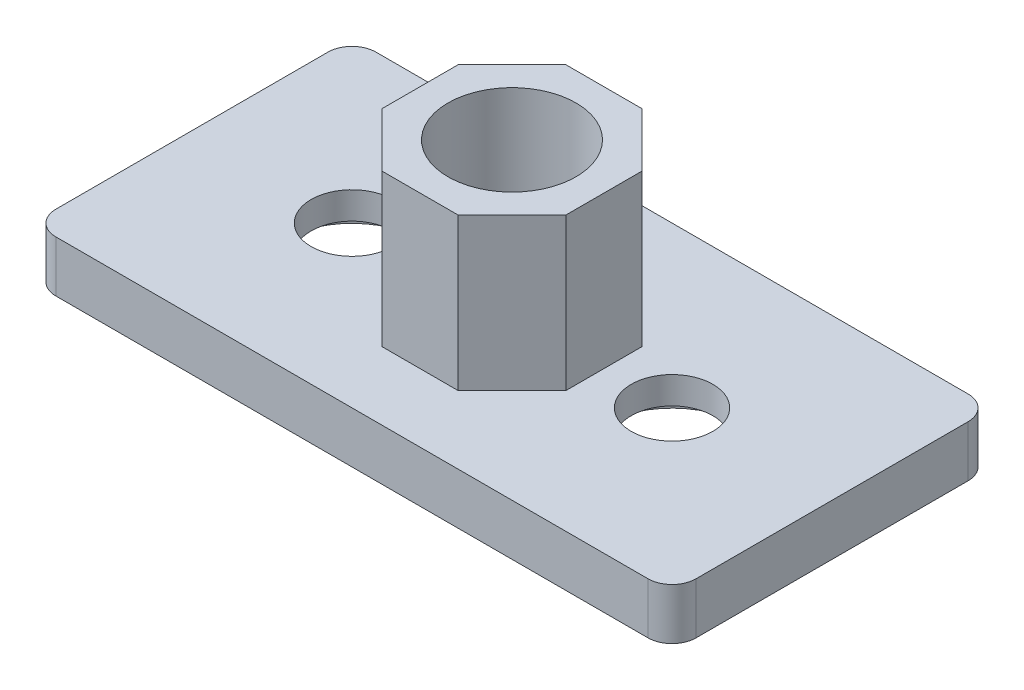
from build123d import *

# Parameters (mm, degrees)
SKETCH1_W           = 40
SKETCH1_H           = 3.2
BOSS_EXTRUDE1_DEPTH = 20
SKETCH3_R           = 2.55
CUT_EXTRUDE2_DEPTH  = 29.464714999
SKETCH5_R           = 4.5
CUT_EXTRUDE4_DEPTH  = 1.5
BOSS_EXTRUDE2_DEPTH = 9.5
SKETCH7_R           = 4
CUT_EXTRUDE5_DEPTH  = 32.004677067
FILLET1_R           = 1.5


with BuildPart() as part:
    # Sketch1 → Boss-Extrude1 (new body)
    with BuildSketch(Plane.XY):
        Rectangle(SKETCH1_W, SKETCH1_H)
    extrude(amount=BOSS_EXTRUDE1_DEPTH)

    # Sketch3 → Cut-Extrude2 (cut, through all)
    with BuildSketch(Plane(origin=(0, 1.6, 0), x_dir=(1, 0, 0), z_dir=(0, 1, 0))):
        with Locations(Location((-10, -10, 0), (0, 0, 180))):
            Circle(SKETCH3_R)
        with Locations((10, -10)):
            Circle(SKETCH3_R)
    extrude(amount=-CUT_EXTRUDE2_DEPTH, mode=Mode.SUBTRACT)

    # Sketch5 → Cut-Extrude4 (cut)
    with BuildSketch(Plane.XZ.offset(1.6)):
        with Locations((10, 10)):
            Circle(SKETCH5_R)
        with Locations((-10, 10)):
            Circle(SKETCH5_R)
    extrude(amount=-CUT_EXTRUDE4_DEPTH, mode=Mode.SUBTRACT)

    # Sketch6 → Boss-Extrude2 (add)
    with BuildSketch(Plane(origin=(0, 1.6, 0), x_dir=(1, 0, 0), z_dir=(0, 1, 0))):
        Polygon((-2.381727984, -4.25), (-5.75, -7.618272016), (-5.75, -12.381727984), (-2.381727984, -15.75), (2.381727984, -15.75), (5.75, -12.381727984), (5.75, -7.618272016), (2.381727984, -4.25), align=None)
    extrude(amount=BOSS_EXTRUDE2_DEPTH)

    # Sketch7 → Cut-Extrude5 (cut, through all)
    with BuildSketch(Plane(origin=(0, 11.1, 0), x_dir=(1, 0, 0), z_dir=(0, 1, 0))):
        with Locations(Location((0, -10, 0), (0, 0, 180))):
            Circle(SKETCH7_R)
    extrude(amount=-CUT_EXTRUDE5_DEPTH, mode=Mode.SUBTRACT)

    # Fillet1
    fillet1_edges = [part.edges().sort_by_distance(p)[0] for p in [
        (20, 0, 20),
        (-20, 0, 20),
        (20, 0, 0),
        (-20, 0, 0),
    ]]
    fillet(fillet1_edges, radius=FILLET1_R)


solid = part.part
